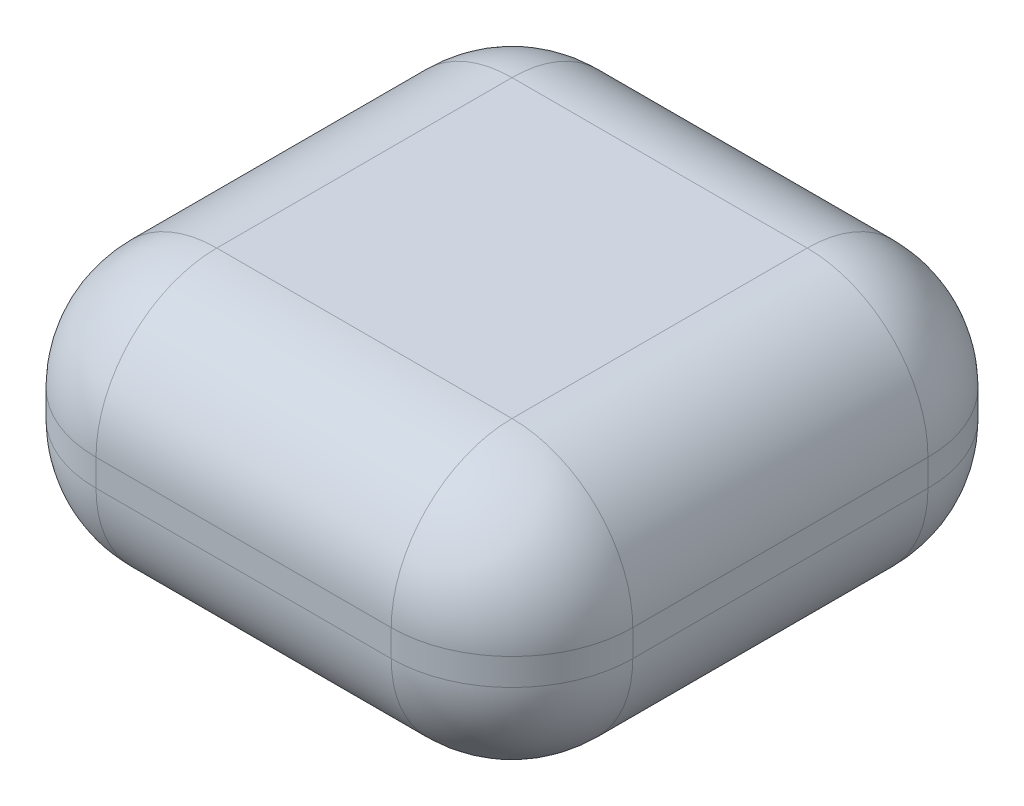
from build123d import *

# Parameters (mm, degrees)
SKETCH1_W           = 200
SKETCH1_H           = 100
BOSS_EXTRUDE1_DEPTH = 100
FILLET1_R           = 45


with BuildPart() as part:
    # Sketch1 → Boss-Extrude1 (new, symmetric)
    with BuildSketch(Plane.XY):
        Rectangle(SKETCH1_W, SKETCH1_H)
    extrude(amount=BOSS_EXTRUDE1_DEPTH, both=True)

    # Fillet1
    fillet1_edges = [part.edges().sort_by_distance(p)[0] for p in [
        (-100, 0, 100),
        (0, -50, 100),
        (100, 0, 100),
        (0, -50, -100),
        (-100, 0, -100),
        (0, 50, -100),
        (100, 0, -100),
        (100, -50, 0),
        (-100, -50, 0),
        (-100, 50, 0),
        (100, 50, 0),
        (0, 50, 100),
    ]]
    fillet(fillet1_edges, radius=FILLET1_R)


solid = part.part
